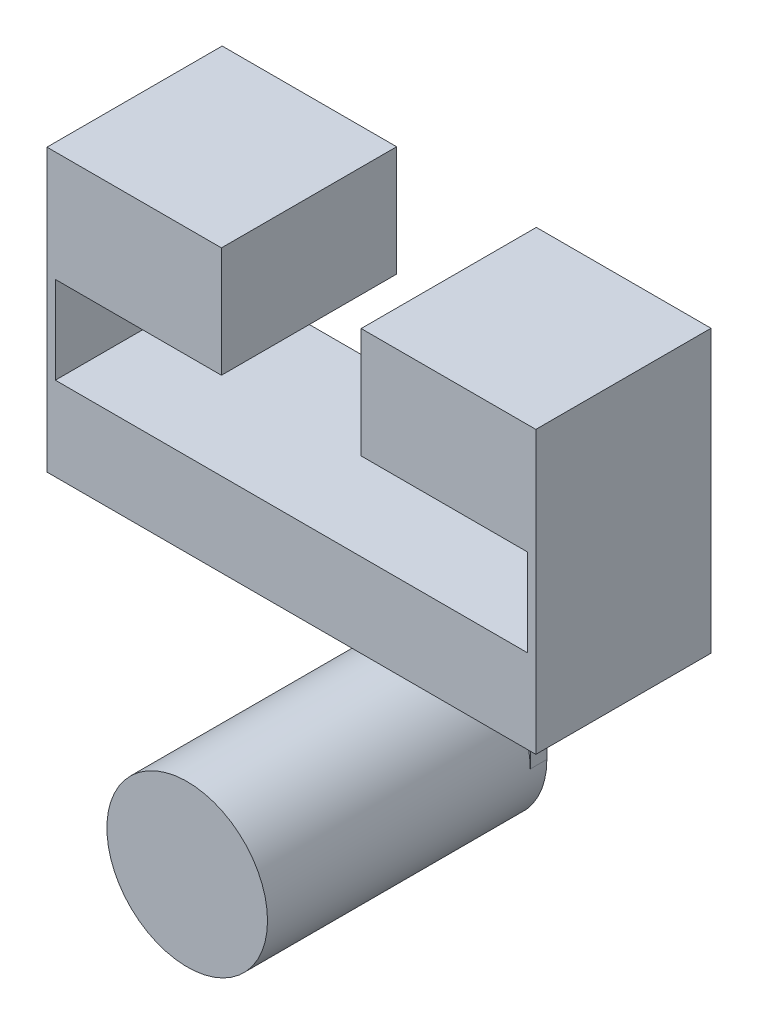
from build123d import *

# Parameters (mm, degrees)
SKETCH1_R           = 14.605
BOSS_EXTRUDE1_DEPTH = 50.8
SKETCH2_W           = 29.21
SKETCH2_H           = 31.649894197
BOSS_EXTRUDE3_DEPTH = 3.02006
BOSS_EXTRUDE4_DEPTH = 15.24
SKETCH4_W           = 1.524
SKETCH4_H           = 31.858022221
BOSS_EXTRUDE6_DEPTH = 15.875
SKETCH5_W           = 31.726657408
SKETCH5_H           = 31.858022221
SKETCH5_W_2         = 31.767634357
BOSS_EXTRUDE7_DEPTH = 20.066


with BuildPart() as part:
    # Sketch1 → Boss-Extrude1 (new body)
    with BuildSketch(Plane.XY):
        Circle(SKETCH1_R)
    extrude(amount=-BOSS_EXTRUDE1_DEPTH)

    # Sketch2 → Boss-Extrude3 (add)
    with BuildSketch(Plane(origin=(0, 0, -50.8), x_dir=(-1, 0, 0), z_dir=(0, 0, -1))):
        with Locations((0, 15.824947099)):
            Rectangle(SKETCH2_W, SKETCH2_H)
    extrude(amount=-BOSS_EXTRUDE3_DEPTH)

    # Sketch3 → Boss-Extrude4 (add)
    with BuildSketch(Plane(origin=(0, 31.649894197, 0), x_dir=(1, 0, 0), z_dir=(0, 1, 0))):
        Polygon((-14.605, 50.8), (-44.442538052, 50.8), (-44.442538052, 18.941977779), (44.457461948, 18.941977779), (44.457461948, 50.8), align=None)
    extrude(amount=BOSS_EXTRUDE4_DEPTH)

    # Sketch4 → Boss-Extrude6 (add)
    with BuildSketch(Plane(origin=(0, 46.889894197, 0), x_dir=(1, 0, 0), z_dir=(0, 1, 0))):
        with Locations((43.695461948, 34.87098889)):
            Rectangle(SKETCH4_W, SKETCH4_H)
        with Locations((-43.680538052, 34.87098889)):
            Rectangle(SKETCH4_W, SKETCH4_H)
    extrude(amount=BOSS_EXTRUDE6_DEPTH)

    # Sketch5 → Boss-Extrude7 (add)
    with BuildSketch(Plane(origin=(0, 62.764894197, 0), x_dir=(1, 0, 0), z_dir=(0, 1, 0))):
        with Locations((-28.579209348, 34.87098889)):
            Rectangle(SKETCH5_W, SKETCH5_H)
        with Locations((28.573644769, 34.87098889)):
            Rectangle(SKETCH5_W_2, SKETCH5_H)
    extrude(amount=BOSS_EXTRUDE7_DEPTH)


solid = part.part
